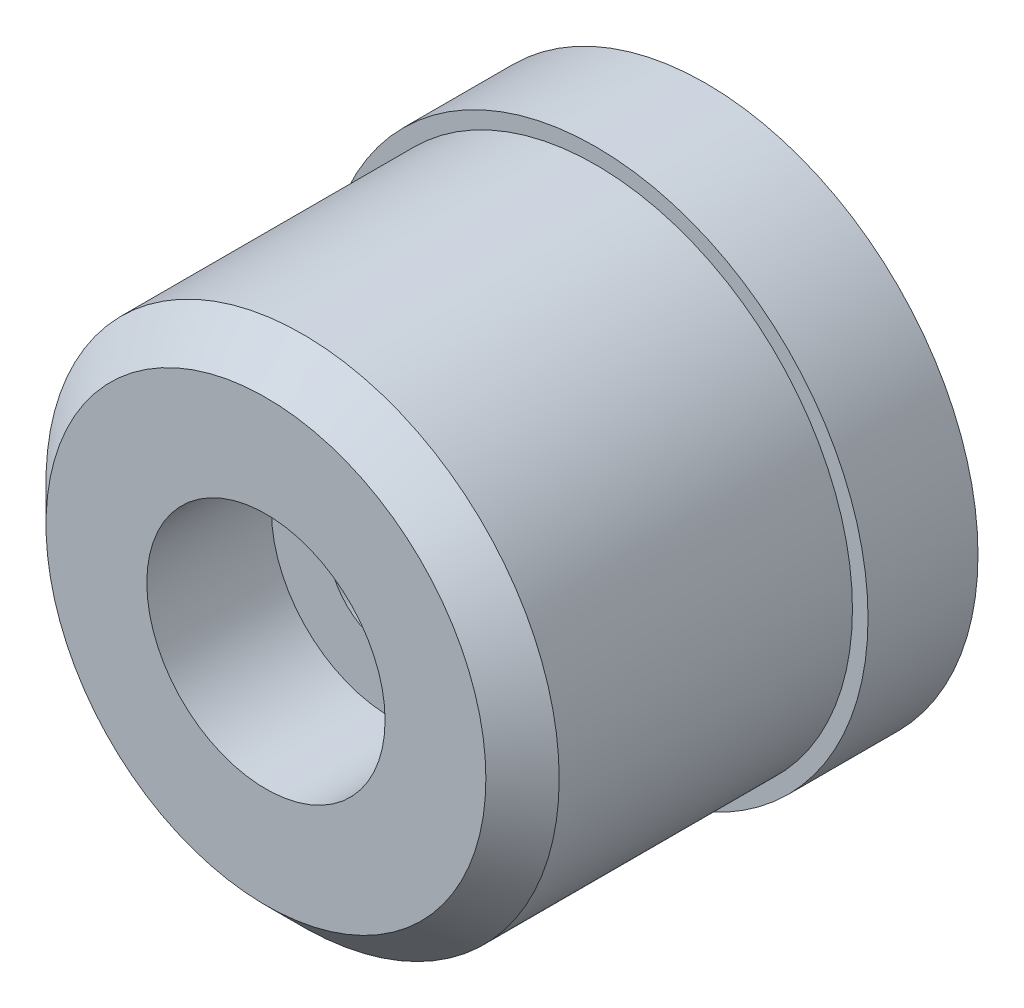
from build123d import *

# Parameters (mm, degrees)
SKETCH_1_R                   = 7.425
EXTRUDE_1_DEPTH              = 3
SKETCH_2_R                   = 7
EXTRUDE_2_DEPTH              = 12
HOLE_WIZARD_M3_1_D           = 3.4
HOLE_WIZARD_M3_1_CBORE_D     = 6.5
HOLE_WIZARD_M3_1_CBORE_DEPTH = 3.4
CHAMFER_1_SIZE               = 1


with BuildPart() as part:
    # 草图1 → 凸台-拉伸1 (new body)
    with BuildSketch(Plane.XY):
        Circle(SKETCH_1_R)
    extrude(amount=EXTRUDE_1_DEPTH)

    # 草图2 → 凸台-拉伸2 (add)
    with BuildSketch(Plane.XY):
        Circle(SKETCH_2_R)
    extrude(amount=EXTRUDE_2_DEPTH)

    # M3 六角凹头螺钉的柱形沉头孔1 (through all)
    with Locations(Plane(origin=(0, 0, 12), x_dir=(-1, 0, 0), z_dir=(0, 0, 1))):
        with Locations((0, 0)):
            CounterBoreHole(HOLE_WIZARD_M3_1_D / 2, HOLE_WIZARD_M3_1_CBORE_D / 2, HOLE_WIZARD_M3_1_CBORE_DEPTH)

    # 倒角1
    chamfer_1_edges = [part.edges().sort_by_distance(p)[0] for p in [
        (-7, 0, 12),
    ]]
    chamfer(chamfer_1_edges, length=CHAMFER_1_SIZE)


solid = part.part
